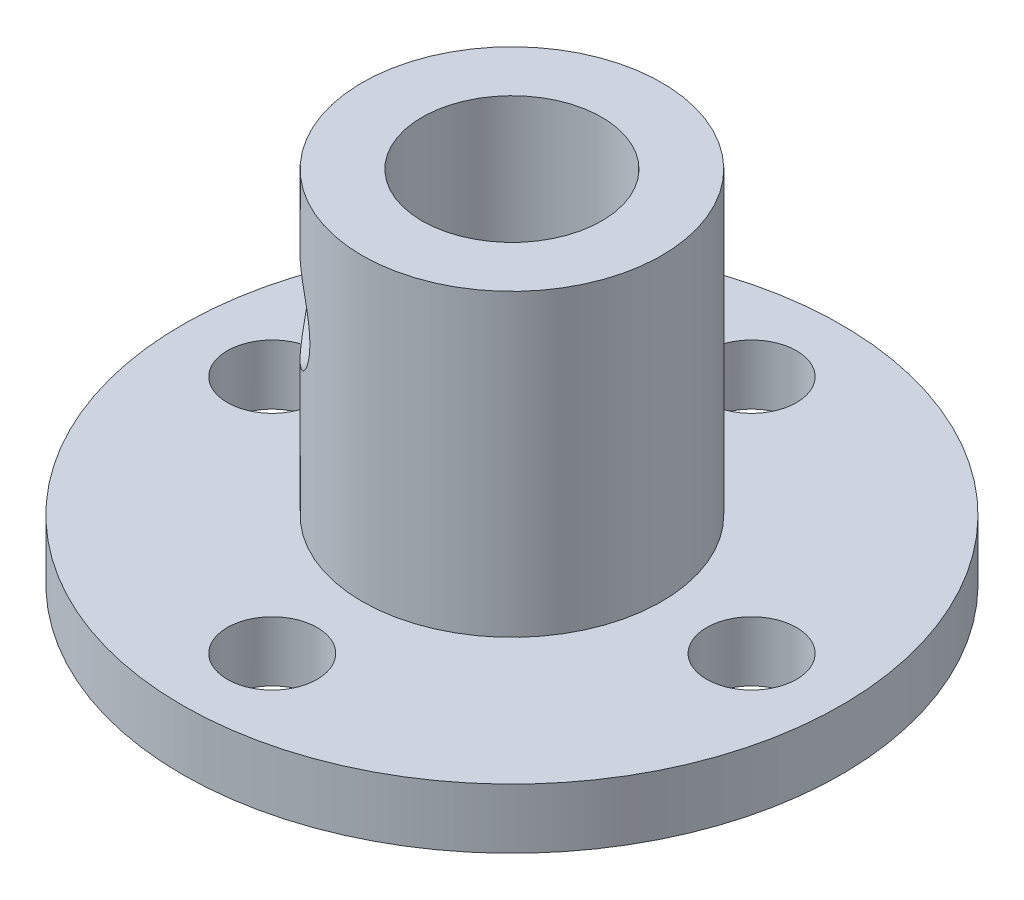
from build123d import *

# Parameters (mm, degrees)
SKETCH1_R           = 11
BOSS_EXTRUDE1_DEPTH = 2
SKETCH2_R           = 5
BOSS_EXTRUDE2_DEPTH = 10
SKETCH3_R           = 3
CUT_EXTRUDE1_DEPTH  = 20
SKETCH5_R           = 1.5
CUT_EXTRUDE2_DEPTH  = 20
SKETCH6_R           = 1.5
CUT_EXTRUDE3_DEPTH  = 20.646882704


with BuildPart() as part:
    # Sketch1 → Boss-Extrude1 (new body)
    with BuildSketch(Plane(origin=(0, 0, 0), x_dir=(1, 0, 0), z_dir=(0, 1, 0))):
        with Locations(Location((0, 0, 0), (0, 0, 270))):
            Circle(SKETCH1_R)
    extrude(amount=BOSS_EXTRUDE1_DEPTH)

    # Sketch2 → Boss-Extrude2 (add)
    with BuildSketch(Plane(origin=(0, 2, 0), x_dir=(1, 0, 0), z_dir=(0, 1, 0))):
        with Locations(Location((0, 0, 0), (0, 0, 270))):
            Circle(SKETCH2_R)
    extrude(amount=BOSS_EXTRUDE2_DEPTH)

    # Sketch3 → Cut-Extrude1 (cut)
    with BuildSketch(Plane(origin=(0, 12, 0), x_dir=(1, 0, 0), z_dir=(0, 1, 0))):
        with Locations(Location((0, 0, 0), (0, 0, 270))):
            Circle(SKETCH3_R)
    extrude(amount=-CUT_EXTRUDE1_DEPTH, mode=Mode.SUBTRACT)

    # Sketch5 → Cut-Extrude2 (cut)
    with BuildSketch(Plane.XZ):
        with Locations(Location((0, 8, 0), (0, 0, 270))):
            Circle(SKETCH5_R)
        with Locations(Location((0, -8, 0), (0, 0, 270))):
            Circle(SKETCH5_R)
        with Locations(Location((8, 0, 0), (0, 0, 270))):
            Circle(SKETCH5_R)
        with Locations(Location((-8, 0, 0), (0, 0, 270))):
            Circle(SKETCH5_R)
    extrude(amount=-CUT_EXTRUDE2_DEPTH, mode=Mode.SUBTRACT)

    # Sketch6 → Cut-Extrude3 (cut, through all)
    with BuildSketch(Plane(origin=(0, 0, 0), x_dir=(-0.7071067811865477, 0, -0.7071067811865475), z_dir=(0.7071067811865475, 0, -0.7071067811865477))):
        with Locations((0, 8)):
            Circle(SKETCH6_R)
    extrude(amount=-CUT_EXTRUDE3_DEPTH, mode=Mode.SUBTRACT)


solid = part.part
